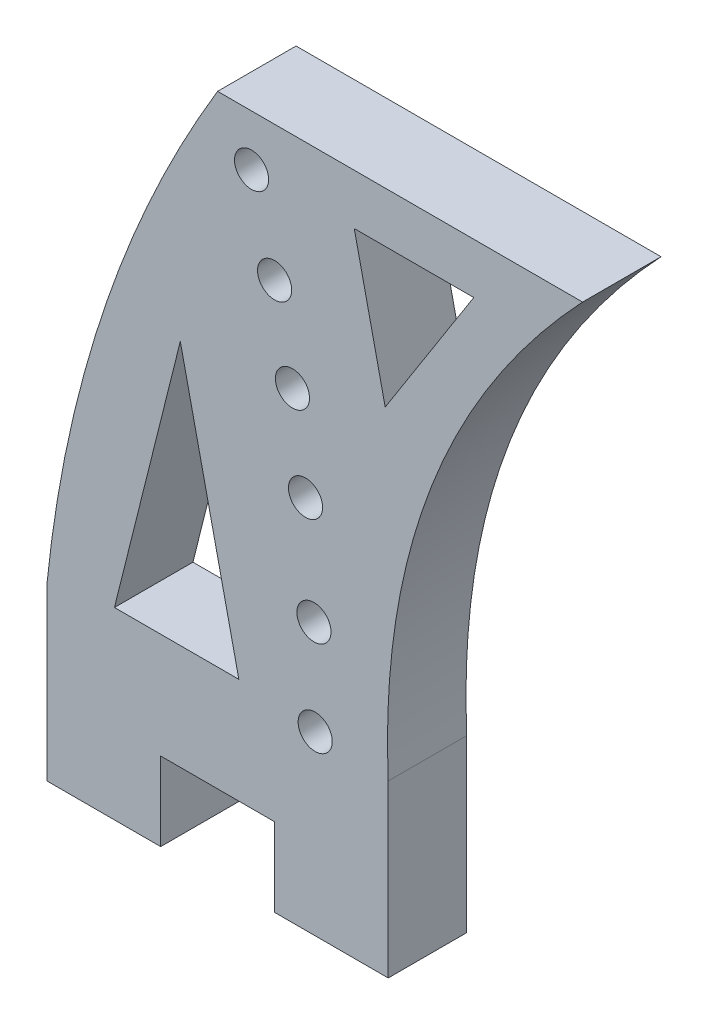
from build123d import *

# Parameters (mm, degrees)
SKETCH3_W           = 25.4
SKETCH3_H           = 12.7
BOSS_EXTRUDE2_DEPTH = 5.842
SKETCH4_W           = 8.466666666
SKETCH4_H           = 5.842
CUT_EXTRUDE1_DEPTH  = 16.35387456
BOSS_EXTRUDE3_DEPTH = 5.842
SKETCH10_R          = 1.27
CUT_EXTRUDE8_DEPTH  = 7.62
SKETCH12_R          = 1.27
CUT_EXTRUDE9_DEPTH  = 7.62
CUT_EXTRUDE10_DEPTH = 7.62


with BuildPart() as part:
    # Sketch3 → Boss-Extrude2 (new body)
    with BuildSketch(Plane.XY):
        Rectangle(SKETCH3_W, SKETCH3_H)
    extrude(amount=BOSS_EXTRUDE2_DEPTH)

    # Sketch4 → Cut-Extrude1 (cut, through all)
    with BuildSketch(Plane.XY.offset(5.842)):
        with Locations((0, -3.429)):
            Rectangle(SKETCH4_W, SKETCH4_H)
    extrude(amount=-CUT_EXTRUDE1_DEPTH, mode=Mode.SUBTRACT)

    # Sketch5 → Boss-Extrude3 (add)
    with BuildSketch(Plane.XY.offset(5.842)):
        with BuildLine():
            Line((0, 44.45), (27.164431218, 44.45))
            add(Edge.make_bspline(
                [(12.7, 6.35), (11.748773867, 28.101932144), (27.164431218, 44.45)],
                knots=[0, 0, 0, 1, 1, 1], degree=2))
            Line((12.7, 6.35), (-12.7, 6.35))
            add(Edge.make_bspline(
                [(-12.7, 6.35), (-10.61981434, 26.757908534), (0, 44.45)],
                knots=[0, 0, 0, 1, 1, 1], degree=2))
        make_face()
    extrude(amount=-BOSS_EXTRUDE3_DEPTH)

    # Sketch10 → Cut-Extrude8 (cut)
    with BuildSketch(Plane.XY.offset(5.842)):
        with Locations((7.264189007, 6.800526763)):
            Circle(SKETCH10_R)
    extrude(amount=-CUT_EXTRUDE8_DEPTH, mode=Mode.SUBTRACT)

    # Sketch12 → Cut-Extrude9 (cut)
    with BuildSketch(Plane.XY.offset(5.842)):
        with Locations((5.572598549, 28.091285842)):
            Circle(SKETCH12_R)
        with Locations((6.546271927, 21.532393633)):
            Circle(SKETCH12_R)
        with Locations((7.173302087, 13.821975993)):
            Circle(SKETCH12_R)
        with Locations((2.529205303, 40.659348041)):
            Circle(SKETCH12_R)
        with Locations((4.243902878, 34.397725849)):
            Circle(SKETCH12_R)
    extrude(amount=-CUT_EXTRUDE9_DEPTH, mode=Mode.SUBTRACT)

    # Sketch13 → Cut-Extrude10 (cut)
    with BuildSketch(Plane.XY.offset(5.842)):
        Polygon((-2.774085904, 26.946129085), (-7.675131543, 7.341946529), (1.582399109, 7.341946529), align=None)
        Polygon((10.172842992, 40.693017541), (12.474681541, 30.334744073), (19.066310112, 40.693017541), align=None)
    extrude(amount=-CUT_EXTRUDE10_DEPTH, mode=Mode.SUBTRACT)


solid = part.part
